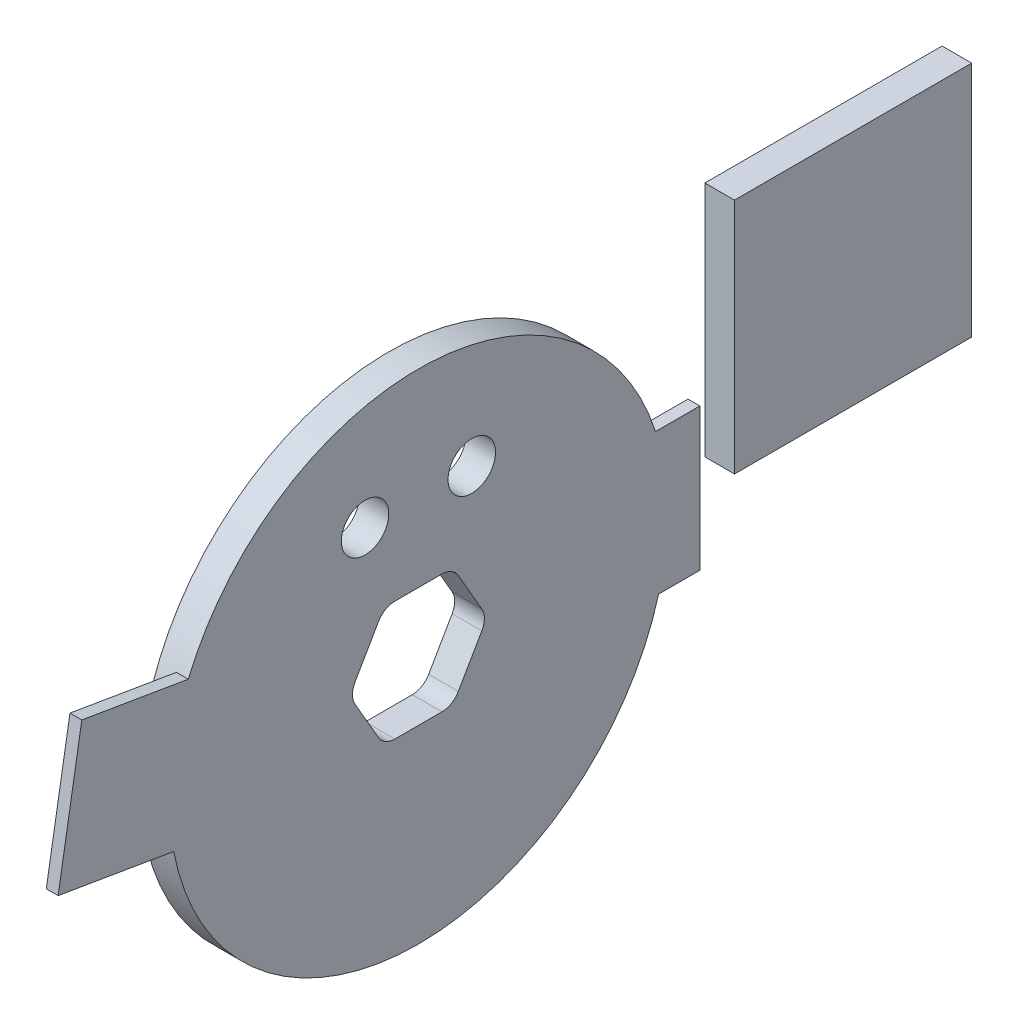
from build123d import *

# Parameters (mm, degrees)
SKETCH1_R           = 29.21
BOSS_EXTRUDE1_DEPTH = 3.175
FILLET1_R           = 2.032
SKETCH3_R           = 2.54
CUT_EXTRUDE2_DEPTH  = 42.431012841
SKETCH4_OUTSIDE_W   = 76.956
SKETCH4_OUTSIDE_H   = 76.956
SKETCH4_OUTSIDE_R   = 26.67
CUT_EXTRUDE3_DEPTH  = 42.431012841
SKETCH7_W           = 25.4
SKETCH7_H           = 25.4
BOSS_EXTRUDE4_DEPTH = 3.175
SKETCH8_W           = 10.832195086
SKETCH8_H           = 15.24
BOSS_EXTRUDE5_DEPTH = 1.27


with BuildPart() as part:
    # Sketch1 → Boss-Extrude1 (new body)
    with BuildSketch(Plane(origin=(0, 0, 0), x_dir=(0, 0, -1), z_dir=(1, 0, 0))):
        Circle(SKETCH1_R)
        Polygon((3.688171255, 6.3881), (-3.688171255, 6.3881), (-7.376342509, 0), (-3.688171255, -6.3881), (3.688171255, -6.3881), (7.376342509, 0), align=None, mode=Mode.SUBTRACT)
    extrude(amount=BOSS_EXTRUDE1_DEPTH)

    # Fillet1
    fillet1_edges = [part.edges().sort_by_distance(p)[0] for p in [
        (1.5875, 6.3881, -3.688171255),
        (1.5875, 6.3881, 3.688171255),
        (1.5875, 0, 7.376342509),
        (1.5875, -6.3881, 3.688171255),
        (1.5875, -6.3881, -3.688171255),
        (1.5875, 0, -7.376342509),
    ]]
    fillet(fillet1_edges, radius=FILLET1_R)

    # Sketch3 → Cut-Extrude2 (cut, through all)
    with BuildSketch(Plane.ZY):
        with Locations((-5.715, 14.810617813)):
            Circle(SKETCH3_R)
        with Locations((5.715, 14.810617813)):
            Circle(SKETCH3_R)
    extrude(amount=-CUT_EXTRUDE2_DEPTH, mode=Mode.SUBTRACT)

    # Sketch4 outside → Cut-Extrude3 (cut, through all)
    with BuildSketch(Plane.ZY):
        Rectangle(SKETCH4_OUTSIDE_W, SKETCH4_OUTSIDE_H)
        Circle(SKETCH4_OUTSIDE_R, mode=Mode.SUBTRACT)
    extrude(amount=-CUT_EXTRUDE3_DEPTH, mode=Mode.SUBTRACT)

    # Sketch8 → Boss-Extrude5 (add)
    with BuildSketch(Plane(origin=(3.175, 0, 0), x_dir=(0, 0, -1), z_dir=(1, 0, 0))):
        Polygon((-20.18704616, 9.464667213), (-22.721085056, -5.56318183), (-38.572167693, -2.890326931), (-36.038128797, 12.137522113), align=None)
        with Locations((24.717087195, 0.546996213)):
            Rectangle(SKETCH8_W, SKETCH8_H)
    extrude(amount=-BOSS_EXTRUDE5_DEPTH)


with BuildPart() as body_2:
    # Sketch7 → Boss-Extrude4 (new body)
    with BuildSketch(Plane(origin=(3.175, 0, 0), x_dir=(0, 0, -1), z_dir=(1, 0, 0))):
        with Locations((46.542333639, 12.7)):
            Rectangle(SKETCH7_W, SKETCH7_H)
    extrude(amount=-BOSS_EXTRUDE4_DEPTH)


solid = Compound([part.part, body_2.part])
